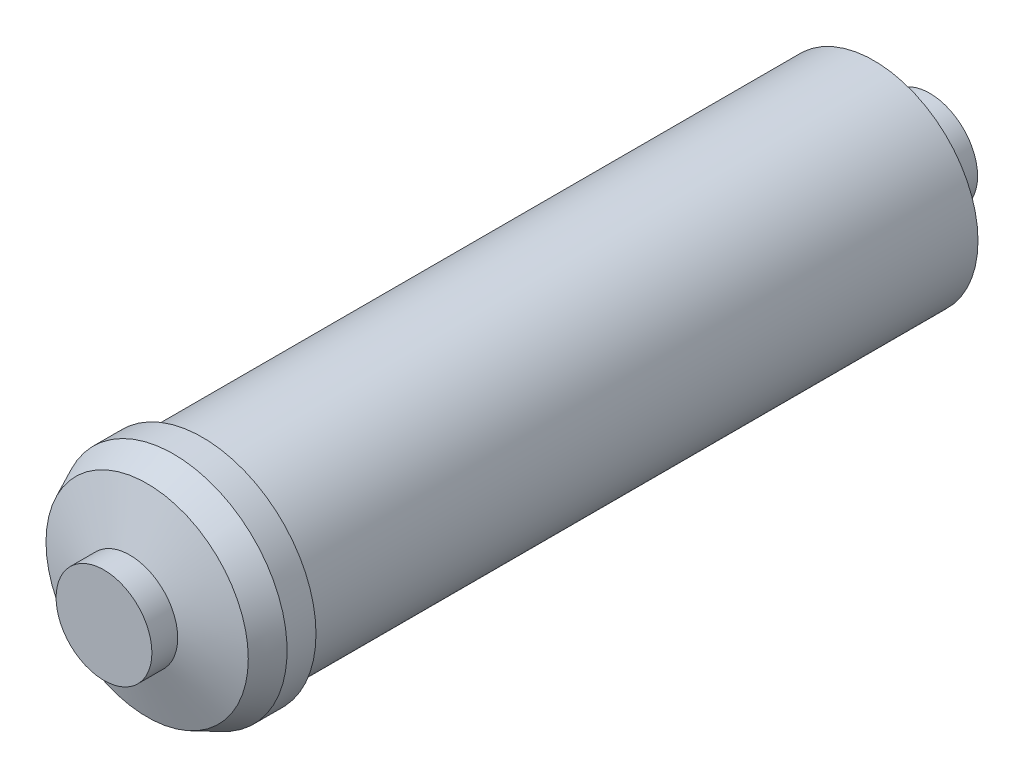
from build123d import *

# Parameters (mm, degrees)
SKETCH1_R           = 14.732
BOSS_EXTRUDE1_DEPTH = 8.255
SKETCH2_R           = 14.732
SKETCH3_R           = 32.004
SKETCH4_R           = 32.004
BOSS_EXTRUDE2_DEPTH = 206.5782
SKETCH5_R           = 34.925
BOSS_EXTRUDE3_DEPTH = 8.89
SKETCH6_R           = 34.925
SKETCH7_R           = 31.115
SKETCH8_R           = 31.115
SKETCH9_R           = 14.732
SKETCH10_R          = 14.732
BOSS_EXTRUDE4_DEPTH = 7.9375


with BuildPart() as part:
    # Sketch1 → Boss-Extrude1 (new body)
    with BuildSketch(Plane.XY):
        Circle(SKETCH1_R)
    extrude(amount=BOSS_EXTRUDE1_DEPTH)

    # Sketch2 → Loft1 section 0
    with BuildSketch(Plane.XY.offset(8.255)):
        Circle(SKETCH2_R)
    # Sketch3 → Loft1 section 1
    with BuildSketch(Plane.XY.offset(17.145)):
        Circle(SKETCH3_R)
    loft()

    # Sketch4 → Boss-Extrude2 (add)
    with BuildSketch(Plane.XY.offset(17.145)):
        Circle(SKETCH4_R)
    extrude(amount=BOSS_EXTRUDE2_DEPTH)

    # Sketch5 → Boss-Extrude3 (add)
    with BuildSketch(Plane.XY.offset(223.7232)):
        Circle(SKETCH5_R)
    extrude(amount=BOSS_EXTRUDE3_DEPTH)

    # Sketch6 → Loft2 section 0
    with BuildSketch(Plane.XY.offset(232.6132)):
        Circle(SKETCH6_R)
    # Sketch7 → Loft2 section 1
    with BuildSketch(Plane.XY.offset(240.7412)):
        Circle(SKETCH7_R)
    loft()

    # Sketch8 → Loft3 section 0
    with BuildSketch(Plane.XY.offset(240.7412)):
        Circle(SKETCH8_R)
    # Sketch9 → Loft3 section 1
    with BuildSketch(Plane.XY.offset(246.0752)):
        Circle(SKETCH9_R)
    loft()

    # Sketch10 → Boss-Extrude4 (add)
    with BuildSketch(Plane.XY.offset(246.0752)):
        Circle(SKETCH10_R)
    extrude(amount=BOSS_EXTRUDE4_DEPTH)


solid = part.part
